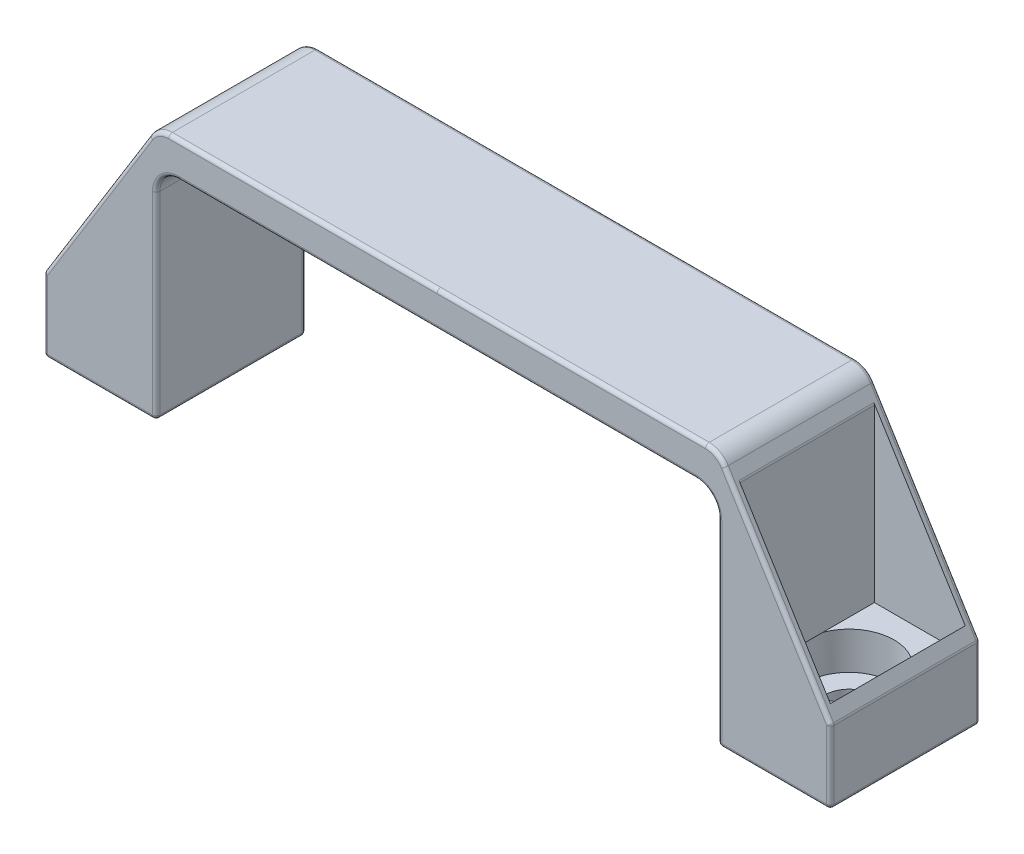
from build123d import *

# Parameters (mm, degrees)
BOSS_EXTRUDE1_DEPTH  = 20
SKETCH2_W            = 12.120438769
SKETCH2_H            = 18
CUT_EXTRUDE1_DEPTH   = 26
SKETCH3_R            = 6
CUT_EXTRUDE2_DEPTH   = 5
CUT_EXTRUDE3_REACH   = 66.166
SKETCH4_R            = 3.25
FILLET3_R            = 0.5
FILLET3_OF_MIRROR1_R = 0.5


with BuildPart() as part:
    # Sketch1 → Boss-Extrude1 (new body)
    with BuildSketch(Plane.XY):
        with BuildLine():
            Line((0, 0), (0, 9.76))
            Line((0, 9.76), (14.120438769, 32.578629051))
            ThreePointArc((14.120438769, 32.578629051), (15.211347014, 33.620676168), (16.671503315, 34))
            Line((16.671503315, 34), (52.5, 34))
            Line((52.5, 34), (52.5, 29.35))
            Line((52.5, 29.35), (18, 29.35))
            ThreePointArc((18, 29.35), (15.878679656, 28.471320344), (15, 26.35))
            Line((15, 26.35), (15, 0))
            Line((15, 0), (0, 0))
        make_face()
    boss_extrude1 = extrude(amount=BOSS_EXTRUDE1_DEPTH)

    # Sketch2 → Cut-Extrude1 (cut)
    with BuildSketch(Plane(origin=(0, 34, 0), x_dir=(1, 0, 0), z_dir=(0, 1, 0))):
        with Locations((7.060219385, -10)):
            Rectangle(SKETCH2_W, SKETCH2_H)
    cut_extrude1 = extrude(amount=-CUT_EXTRUDE1_DEPTH, mode=Mode.SUBTRACT)

    # Sketch3 → Cut-Extrude2 (cut)
    with BuildSketch(Plane(origin=(0, 8, 0), x_dir=(1, 0, 0), z_dir=(0, 1, 0))):
        with Locations(Location((7.5, -10, 0), (0, 0, 270))):
            Circle(SKETCH3_R)
    cut_extrude2 = extrude(amount=-CUT_EXTRUDE2_DEPTH, mode=Mode.SUBTRACT)

    # Sketch4 → Cut-Extrude3 (cut, up to next)
    with BuildSketch(Plane(origin=(0, 3, 0), x_dir=(1, 0, 0), z_dir=(0, 1, 0)), mode=Mode.PRIVATE) as cut_extrude3_sk1:
        with Locations(Location((7.5, -10, 0), (0, 0, 270))):
            Circle(SKETCH4_R)
    cut_extrude3_tool1 = extrude(cut_extrude3_sk1.sketch, amount=-CUT_EXTRUDE3_REACH, mode=Mode.PRIVATE) & part.part
    cut_extrude3 = cut_extrude3_tool1.solids().sort_by_distance((7.5, 3, 10))[0]
    add(cut_extrude3, mode=Mode.SUBTRACT)

    # Fillet3
    fillet3_edges = [part.edges().sort_by_distance(p)[0] for p in [
        (15.211347014, 33.620676168, 0),
        (34.585751658, 34, 0),
        (35.25, 29.35, 0),
        (15.878679656, 28.471320344, 0),
        (15, 13.175, 0),
        (7.5, 0, 0),
        (15.878679656, 28.471320344, 20),
        (0, 0, 10),
        (0, 9.76, 10),
        (15, 0, 10),
        (35.25, 29.35, 20),
        (34.585751658, 34, 20),
        (13.120438769, 30.962629051, 10),
        (15.211347014, 33.620676168, 20),
        (7.060219385, 21.169314525, 20),
        (0, 4.88, 20),
        (7.5, 0, 20),
        (15, 13.175, 20),
        (0, 4.88, 0),
        (7.060219385, 21.169314525, 0),
    ]]
    fillet(fillet3_edges, radius=FILLET3_R)

    # Mirror1: Boss-Extrude1, Cut-Extrude1, Cut-Extrude2, Cut-Extrude3 across plane
    add(boss_extrude1.mirror(Plane(origin=(52.5, 34, 20), x_dir=(0, 0, 1), z_dir=(-1, 0, 0))))
    add(cut_extrude1.mirror(Plane(origin=(52.5, 34, 20), x_dir=(0, 0, 1), z_dir=(-1, 0, 0))), mode=Mode.SUBTRACT)
    add(cut_extrude2.mirror(Plane(origin=(52.5, 34, 20), x_dir=(0, 0, 1), z_dir=(-1, 0, 0))), mode=Mode.SUBTRACT)
    add(cut_extrude3.mirror(Plane(origin=(52.5, 34, 20), x_dir=(0, 0, 1), z_dir=(-1, 0, 0))), mode=Mode.SUBTRACT)

    # Fillet3 of Mirror1
    fillet3_of_mirror1_edges = [part.edges().sort_by_distance(p)[0] for p in [
        (89.788652986, 33.620676168, 0),
        (70.414248342, 34, 0),
        (69.75, 29.35, 0),
        (89.121320344, 28.471320344, 0),
        (90, 13.175, 0),
        (97.5, 0, 0),
        (89.121320344, 28.471320344, 20),
        (105, 0, 10),
        (105, 9.76, 10),
        (90, 0, 10),
        (69.75, 29.35, 20),
        (70.414248342, 34, 20),
        (91.879561231, 30.962629051, 10),
        (89.788652986, 33.620676168, 20),
        (97.939780615, 21.169314525, 20),
        (105, 4.88, 20),
        (97.5, 0, 20),
        (90, 13.175, 20),
        (105, 4.88, 0),
        (97.939780615, 21.169314525, 0),
    ]]
    fillet(fillet3_of_mirror1_edges, radius=FILLET3_OF_MIRROR1_R)


solid = part.part
